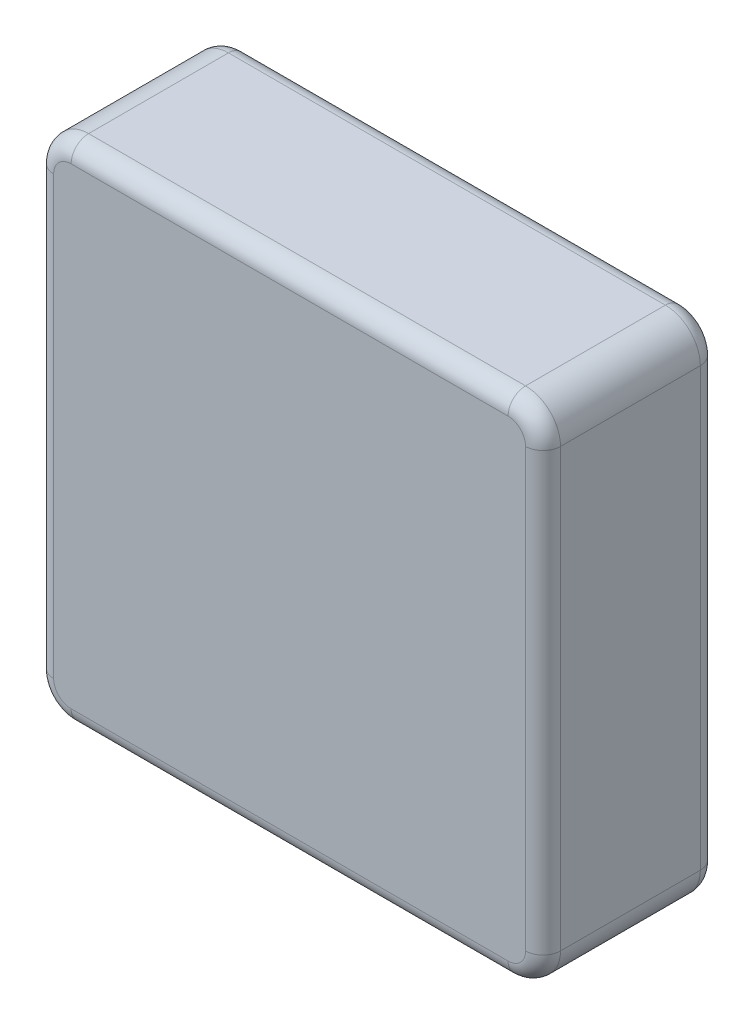
from build123d import *

# Parameters (mm, degrees)
ESQUISSE1_W           = 29
ESQUISSE1_H           = 29
BOSS_EXTRU_1_DEPTH    = 10
TROU_TARAUD_M32_D     = 2.5
TROU_TARAUD_M32_DEPTH = 8.5
TROU_TARAUD_M32_TIP   = 0.751075774
CONG_2_R              = 2
CONG_1_R              = 1


with BuildPart() as part:
    # Esquisse1 → Boss.-Extru.1 (new body)
    with BuildSketch(Plane.XY):
        Rectangle(ESQUISSE1_W, ESQUISSE1_H)
    extrude(amount=BOSS_EXTRU_1_DEPTH)

    # Trou taraudé M32
    with Locations(Plane(origin=(0, 0, 0), x_dir=(-1, 0, 0), z_dir=(0, 0, -1))):
        with Locations((-11, 11), (11, -11)):
            Hole(TROU_TARAUD_M32_D / 2, depth=TROU_TARAUD_M32_DEPTH)
            with Locations((0, 0, -(TROU_TARAUD_M32_DEPTH + TROU_TARAUD_M32_TIP / 2))):  # 118° drill point
                Cone(0, TROU_TARAUD_M32_D / 2, TROU_TARAUD_M32_TIP, mode=Mode.SUBTRACT)

    # Congé 2
    cong_2_edges = [part.edges().sort_by_distance(p)[0] for p in [
        (-14.5, 14.5, 5),
        (14.5, 14.5, 5),
        (14.5, -14.5, 5),
        (-14.5, -14.5, 5),
    ]]
    fillet(cong_2_edges, radius=CONG_2_R)

    # Congé1
    cong_1_edges = [part.edges().sort_by_distance(p)[0] for p in [
        (0, -14.5, 0),
        (0, -14.5, 10),
        (-14.5, 0, 0),
        (0, 14.5, 0),
        (14.5, 0, 0),
        (-13.914213562, 13.914213562, 0),
        (13.914213562, 13.914213562, 0),
        (13.914213562, -13.914213562, 0),
        (-13.914213562, -13.914213562, 0),
        (-14.5, 0, 10),
        (14.5, 0, 10),
        (0, 14.5, 10),
        (-13.914213562, 13.914213562, 10),
        (13.914213562, 13.914213562, 10),
        (13.914213562, -13.914213562, 10),
        (-13.914213562, -13.914213562, 10),
    ]]
    fillet(cong_1_edges, radius=CONG_1_R)


solid = part.part
